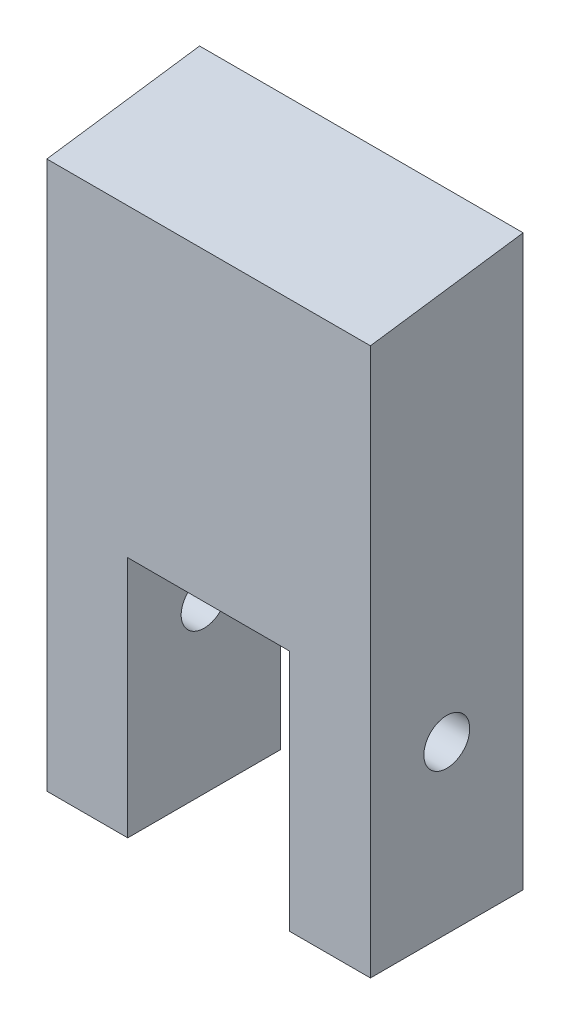
from build123d import *

# Parameters (mm, degrees)
BOSS_EXTRUDE1_DEPTH  = 25.4
SKETCH2_W            = 12.7
SKETCH2_H            = 19.05
CUT_EXTRUDE1_DEPTH   = 53.76066686
M3_CLEARANCE_HOLE1_D = 3.6


with BuildPart() as part:
    # Sketch1 → Boss-Extrude1 (new body)
    with BuildSketch(Plane(origin=(0, 0, 0), x_dir=(0, 0, -1), z_dir=(1, 0, 0))):
        Polygon((0, 0), (11.9888, 0), (11.9888, 44.663146352), (0, 42.978230393), align=None)
    extrude(amount=BOSS_EXTRUDE1_DEPTH)

    # Sketch2 → Cut-Extrude1 (cut, through all)
    with BuildSketch(Plane.XY):
        with Locations((12.7, 9.525)):
            Rectangle(SKETCH2_W, SKETCH2_H)
    extrude(amount=-CUT_EXTRUDE1_DEPTH, mode=Mode.SUBTRACT)

    # M3 Clearance Hole1 (through all)
    with Locations(Plane(origin=(25.4, 0, 0), x_dir=(0, 0, -1), z_dir=(1, 0, 0))):
        with Locations((5.9944, 13.0556)):
            Hole(M3_CLEARANCE_HOLE1_D / 2)


solid = part.part
